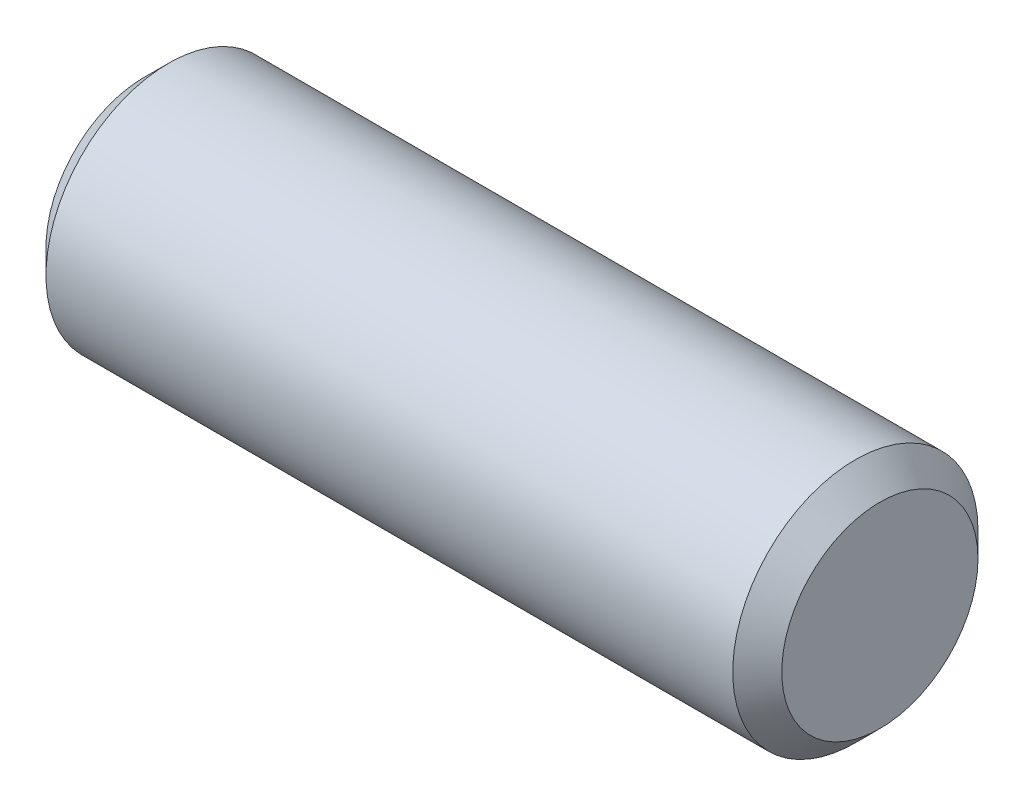
from build123d import *

# Parameters (mm, degrees)
EXTRUDE1_DEPTH      = 7.14375
EXTRUDE1_DEPTH_BACK = 7.14375
SKETCH2_R           = 2.38125
CHAMFER1_SIZE       = 0.47625


with BuildPart() as part:
    # Sketch2 → Extrude1 (new, two sides: drawn at the far end of the back side and taken through both)
    with BuildSketch(Plane(origin=(0, 0, 0), x_dir=(0, 0, -1), z_dir=(1, 0, 0)).offset(-EXTRUDE1_DEPTH_BACK)):
        Circle(SKETCH2_R)
    extrude(amount=EXTRUDE1_DEPTH + EXTRUDE1_DEPTH_BACK)

    # Chamfer1
    chamfer1_edges = [part.edges().sort_by_distance(p)[0] for p in [
        (-7.14375, 0, 2.38125),
        (7.14375, 0, 2.38125),
    ]]
    chamfer(chamfer1_edges, length=CHAMFER1_SIZE)


solid = part.part
